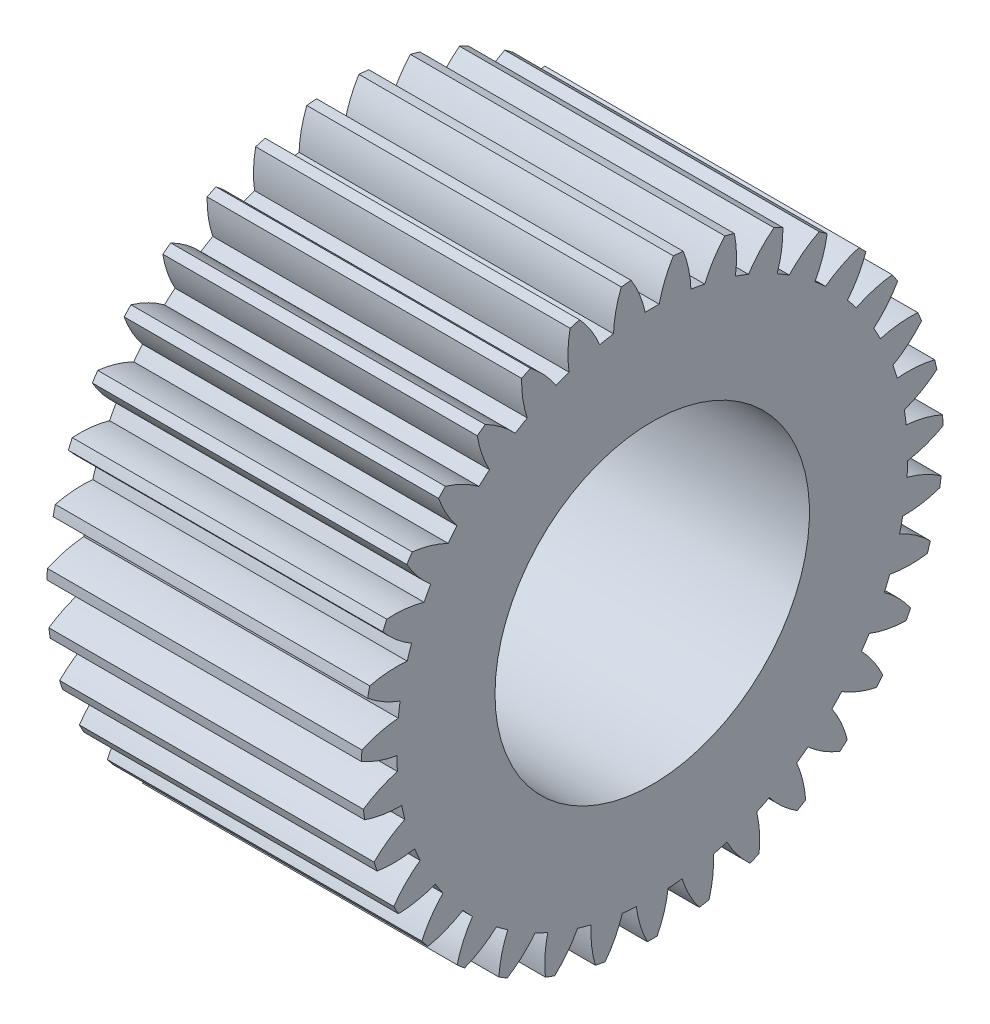
from build123d import *

# Parameters (mm, degrees)
BASPROSKE_W     = 5
BASPROSKE_H     = 4.625
TOOTHCUT_DEPTH  = 9.2329369
TEETHCUTS_COUNT = 35
TEETHCUTS_ANGLE = 349.714285714
BORSKE_R        = 2.5
BORE_DEPTH      = 50.0000508


with BuildPart() as part:
    # BasProSke → Base-Revolve (revolve)
    with BuildSketch(Plane(origin=(0, 0, 0), x_dir=(1, 0, 0), z_dir=(0, 1, 0)), mode=Mode.PRIVATE) as base_revolve_sk:
        with Locations((2.5, 2.3125)):
            Rectangle(BASPROSKE_W, BASPROSKE_H)
    revolve(base_revolve_sk.sketch.rotate(Axis((-10, 0, 0), (1, 0, 0)), 180), axis=Axis((-10, 0, 0), (1, 0, 0)))

    # TooCutSke → ToothCut (cut, through all)
    with BuildSketch(Plane(origin=(0, 0, 0), x_dir=(0, 0, -1), z_dir=(1, 0, 0))):
        with BuildLine():
            ThreePointArc((0.1114884, 4.05996953), (0, 4.0615), (-0.1114884, 4.05996953))
            ThreePointArc((-0.1114884, 4.05996953), (-0.205820695, 4.359343398), (-0.352115662, 4.637050218))
            ThreePointArc((-0.352115662, 4.637050218), (0, 4.6504), (0.352115662, 4.637050218))
            ThreePointArc((0.352115662, 4.637050218), (0.205820695, 4.359343398), (0.1114884, 4.05996953))
        make_face()
    toothcut = extrude(amount=TOOTHCUT_DEPTH, mode=Mode.SUBTRACT)

    # TeethCuts: ToothCut ×35 about axis
    teethcuts_axis = Axis((-10, 0, 0), (1, 0, 0))
    for i in range(1, TEETHCUTS_COUNT):
        add(toothcut.rotate(teethcuts_axis, i * TEETHCUTS_ANGLE / (TEETHCUTS_COUNT - 1)), mode=Mode.SUBTRACT)

    # BorSke → Bore (cut, symmetric)
    with BuildSketch(Plane(origin=(0, 0, 0), x_dir=(0, 0, -1), z_dir=(1, 0, 0))):
        with Locations(Location((0, 0, 0), (0, 0, 180))):
            Circle(BORSKE_R)
    extrude(amount=BORE_DEPTH, both=True, mode=Mode.SUBTRACT)


solid = part.part
